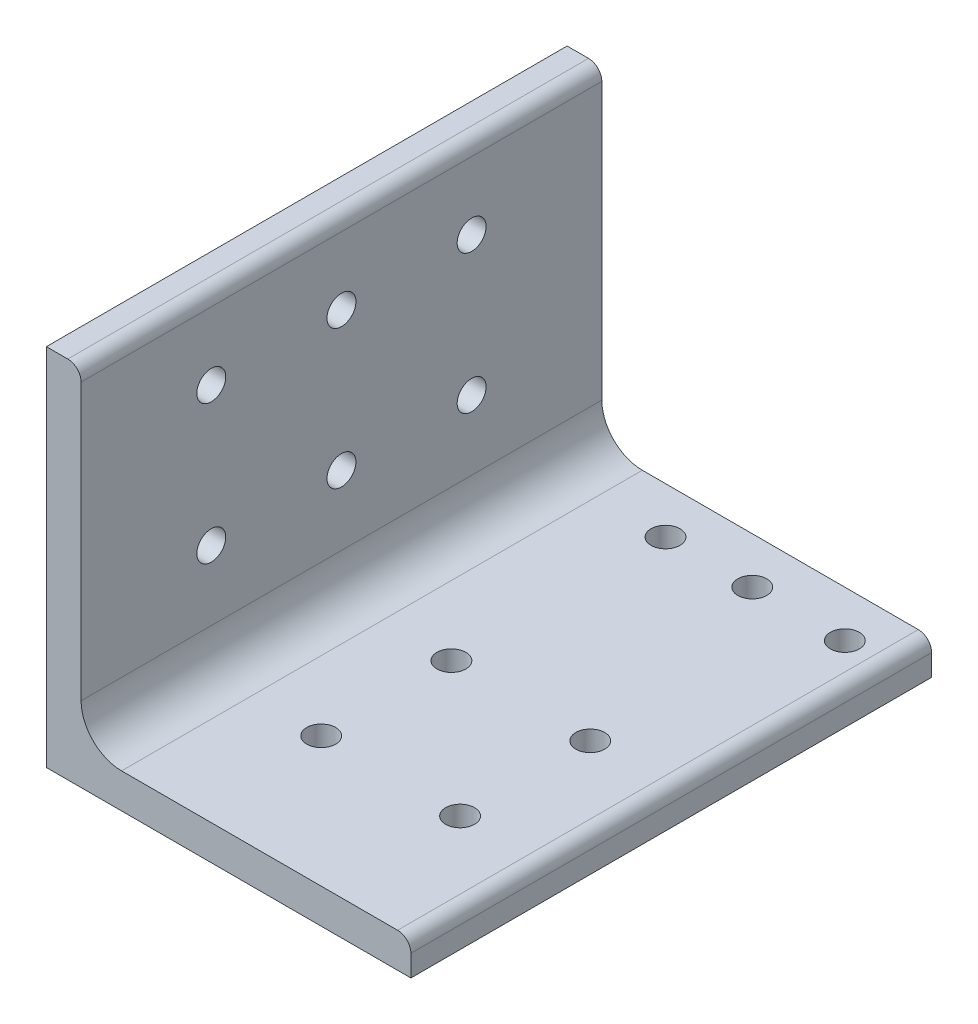
from build123d import *

# Parameters (mm, degrees)
AUFSATZ_LINEAR_AUSTRAGEN1_DEPTH = 90
F_5_0_5_DURCHMESSER_BOHRUNG1_D  = 5
F_5_0_5_DURCHMESSER_BOHRUNG2_D  = 5


with BuildPart() as part:
    # Skizze2 → Aufsatz-Linear austragen1 (new body)
    with BuildSketch(Plane.XY):
        with BuildLine():
            ThreePointArc((6, 13), (8.050252532, 8.050252532), (13, 6))
            Line((13, 6), (60.7, 6))
            ThreePointArc((60.7, 6), (62.326345597, 5.326345597), (63, 3.7))
            Line((63, 3.7), (63, 0))
            Line((63, 0), (0, 0))
            Line((0, 0), (0, 63))
            Line((0, 63), (3.7, 63))
            ThreePointArc((3.7, 63), (5.326345597, 62.326345597), (6, 60.7))
            Line((6, 60.7), (6, 13))
        make_face()
    extrude(amount=AUFSATZ_LINEAR_AUSTRAGEN1_DEPTH)

    # Ø5.0 (5) Durchmesser Bohrung1 (through all)
    with Locations(Plane(origin=(6, 25, 67.5), x_dir=(0, 1, 0), z_dir=(1, 0, 0))):
        with Locations((0, 0), (24, 0), (24, -22.5), (0, -22.5), (0, -45), (24, -45)):
            Hole(F_5_0_5_DURCHMESSER_BOHRUNG1_D / 2)

    # Ø5.0 (5) Durchmesser Bohrung2 (through all)
    with Locations(Plane(origin=(49, 6, 67.5), x_dir=(0, 0, 1), z_dir=(0, 1, 0))):
        with Locations((0, 0), (-22.5, 0), (-22.5, -24), (0, -24), (-59.5, -24), (-59.5, -9), (-59.5, 7)):
            Hole(F_5_0_5_DURCHMESSER_BOHRUNG2_D / 2)


solid = part.part
